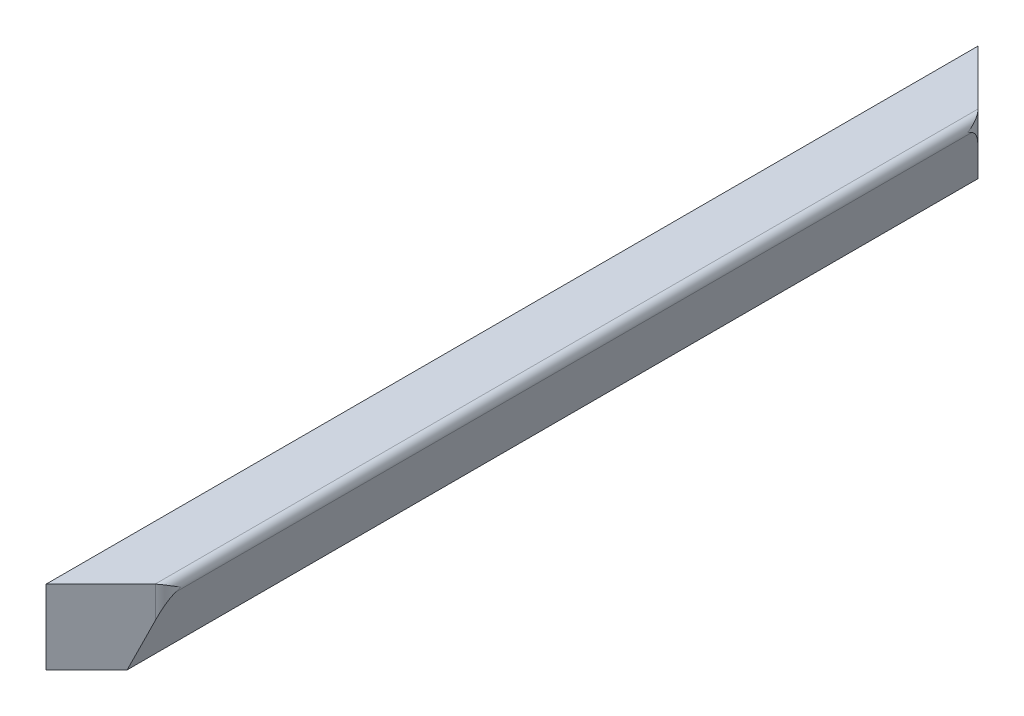
from build123d import *

# Parameters (mm, degrees)
SALIENTE_EXTRUIR1_DEPTH = 36.76416917
CORTAR_EXTRUIR1_REACH   = 46.527


with BuildPart() as part:
    # Croquis1 → Saliente-Extruir1 (new body)
    with BuildSketch(Plane.XY):
        with BuildLine():
            Line((-24.95, 2.07), (-24.95, 5))
            Line((-24.95, 5), (-22.8, 5))
            ThreePointArc((-22.8, 5), (-22.55695313, 4.875864205), (-22.515045035, 4.606188125))
            Line((-22.515045035, 4.606188125), (-23.35, 2.07))
            Line((-23.35, 2.07), (-24.95, 2.07))
        make_face()
    extrude(amount=-SALIENTE_EXTRUIR1_DEPTH)

    # Cortar-Extruir1: up to this face of the body (flat: up to its plane)
    cortar_extruir1_end = Plane(part.part.faces().sort_by_distance((-24.15, 2.07, -18.382084585))[0])
    # Croquis3 → Cortar-Extruir1 (cut, up to the picked face)
    with BuildSketch(Plane(origin=(0, 5, 0), x_dir=(1, 0, 0), z_dir=(0, 1, 0)), mode=Mode.PRIVATE) as cortar_extruir1_sk1:
        with BuildLine():
            Line((-24.95, 36.76416917), (-22.792893219, 34.607062389))
            ThreePointArc((-22.792893219, 34.607062389), (-22.576120467, 34.28263904), (-22.5, 33.899955608))
            Line((-22.5, 33.899955608), (-22.5, 2.864213562))
            ThreePointArc((-22.5, 2.864213562), (-22.576120467, 2.48153013), (-22.792893219, 2.157106781))
            Line((-22.792893219, 2.157106781), (-24.95, 0))
            Line((-24.95, 0), (-24.95, -1.353882683))
            Line((-24.95, -1.353882683), (-20.676224188, -1.353882683))
            Line((-20.676224188, -1.353882683), (-20.676224188, 38.571872723))
            Line((-20.676224188, 38.571872723), (-24.95, 38.571872723))
            Line((-24.95, 38.571872723), (-24.95, 36.76416917))
        make_face()
    cortar_extruir1_tool1 = split(extrude(cortar_extruir1_sk1.sketch, amount=-CORTAR_EXTRUIR1_REACH, mode=Mode.PRIVATE), bisect_by=cortar_extruir1_end, keep=Keep.BOTH, mode=Mode.PRIVATE)
    add(cortar_extruir1_tool1.solids().sort_by(Axis((-21.899514, 5, -18.829145), (0, -1, 0)))[0], mode=Mode.SUBTRACT)


solid = part.part
